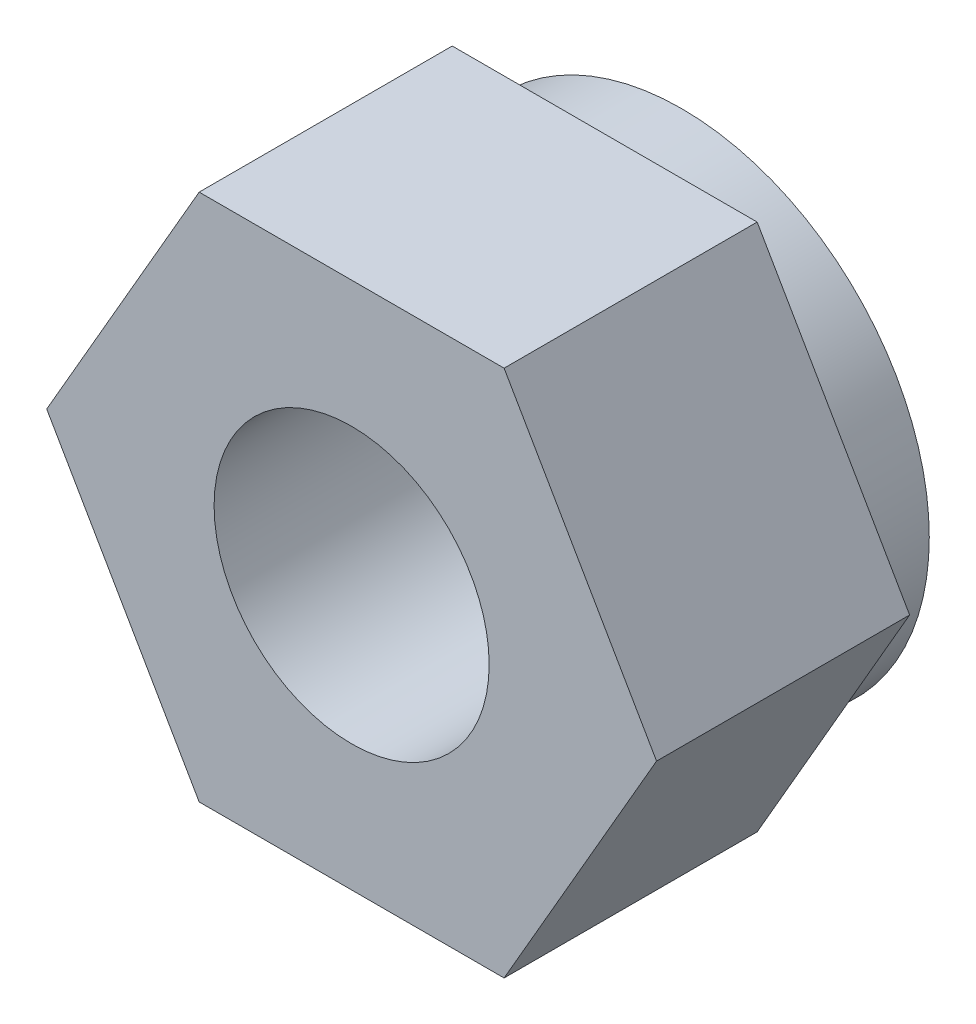
from build123d import *
from build123d.topology import SkipClean

# Parameters (mm, degrees)
SKETCH_1_R      = 1.25
EXTRUDE_1_DEPTH = 2.3
EXTRUDE_START   = 0.7
SKETCH_2_R      = 2.25
SKETCH_2_R_2    = 1.25
EXTRUDE_2_DEPTH = 0.7


with BuildPart() as part:
    # 草图1 → 凸台-拉伸1 (new body)
    with BuildSketch(Plane.XY):
        Polygon((-1.385640646, 2.4), (-2.771281292, 0), (-1.385640646, -2.4), (1.385640646, -2.4), (2.771281292, 0), (1.385640646, 2.4), align=None)
        Circle(SKETCH_1_R, mode=Mode.SUBTRACT)
    extrude(amount=EXTRUDE_1_DEPTH)

    # 草图2 → 凸台-拉伸2 (add)
    with SkipClean():  # the faces are left unmerged after this step: merging them gives an invalid solid
        with BuildSketch(Plane(origin=(0, 0, 0), x_dir=(-1, 0, 0), z_dir=(0, 0, -1)).offset(EXTRUDE_START)):
            Circle(SKETCH_2_R)
            Circle(SKETCH_2_R_2, mode=Mode.SUBTRACT)
        extrude(amount=-EXTRUDE_2_DEPTH)


solid = part.part
